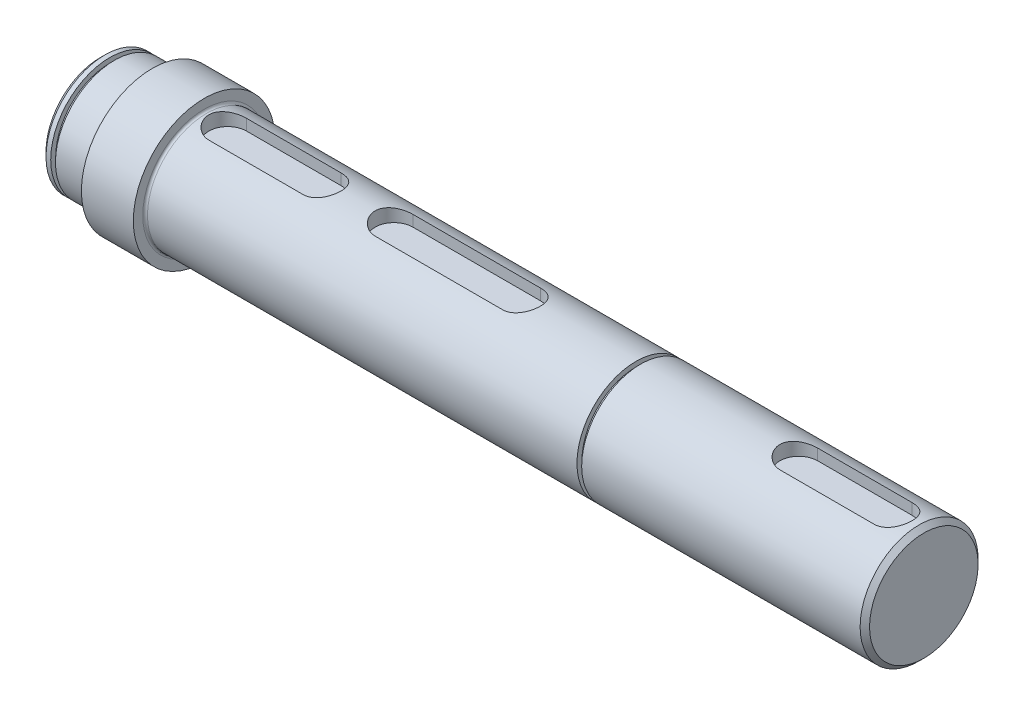
from build123d import *

# Parameters (mm, degrees)
CUT_EXTRUDE1_DEPTH = 6
CUT_EXTRUDE2_DEPTH = 6
FILLET1_R          = 1
CUT_EXTRUDE3_DEPTH = 6


with BuildPart() as part:
    # Sketch1 → Revolve1 (revolve)
    with BuildSketch(Plane.XY, mode=Mode.PRIVATE) as revolve1_sk:
        Polygon((0, 0), (349, 0), (349, 23), (347, 25), (229, 25), (229, 22.9), (227, 22.9), (227, 25), (44, 25), (44, 30), (22, 30), (22, 25), (6, 25), (6, 22.9), (4, 22.9), (4, 25), (2, 25), (0, 23), align=None)
    revolve(revolve1_sk.sketch.rotate(Axis((0, 0, 0), (1, 0, 0)), 90), axis=Axis((0, 0, 0), (1, 0, 0)))

    # Sketch2 → Cut-Extrude1 (cut)
    with BuildSketch(Plane(origin=(0, 25, 0), x_dir=(1, 0, 0), z_dir=(0, 1, 0))):
        with BuildLine():
            Line((54, 8), (94, 8))
            ThreePointArc((94, 8), (102, 0), (94, -8))
            Line((94, -8), (54, -8))
            ThreePointArc((54, -8), (46, 0), (54, 8))
        make_face()
    extrude(amount=-CUT_EXTRUDE1_DEPTH, mode=Mode.SUBTRACT)

    # Sketch3 → Cut-Extrude2 (cut)
    with BuildSketch(Plane(origin=(0, 25, 0), x_dir=(1, 0, 0), z_dir=(0, 1, 0))):
        with BuildLine():
            Line((124.5, 8), (178.5, 8))
            ThreePointArc((178.5, 8), (186.5, 0), (178.5, -8))
            Line((178.5, -8), (124.5, -8))
            ThreePointArc((124.5, -8), (116.5, 0), (124.5, 8))
        make_face()
    extrude(amount=-CUT_EXTRUDE2_DEPTH, mode=Mode.SUBTRACT)

    # Fillet1
    fillet1_edges = [part.edges().sort_by_distance(p)[0] for p in [
        (44, 0, -25),
    ]]
    fillet(fillet1_edges, radius=FILLET1_R)

    # Sketch4 → Cut-Extrude3 (cut)
    with BuildSketch(Plane(origin=(0, 25, 0), x_dir=(1, 0, 0), z_dir=(0, 1, 0))):
        with BuildLine():
            Line((296, 8), (336, 8))
            ThreePointArc((336, 8), (344, 0), (336, -8))
            Line((336, -8), (296, -8))
            ThreePointArc((296, -8), (288, 0), (296, 8))
        make_face()
    extrude(amount=-CUT_EXTRUDE3_DEPTH, mode=Mode.SUBTRACT)


solid = part.part
